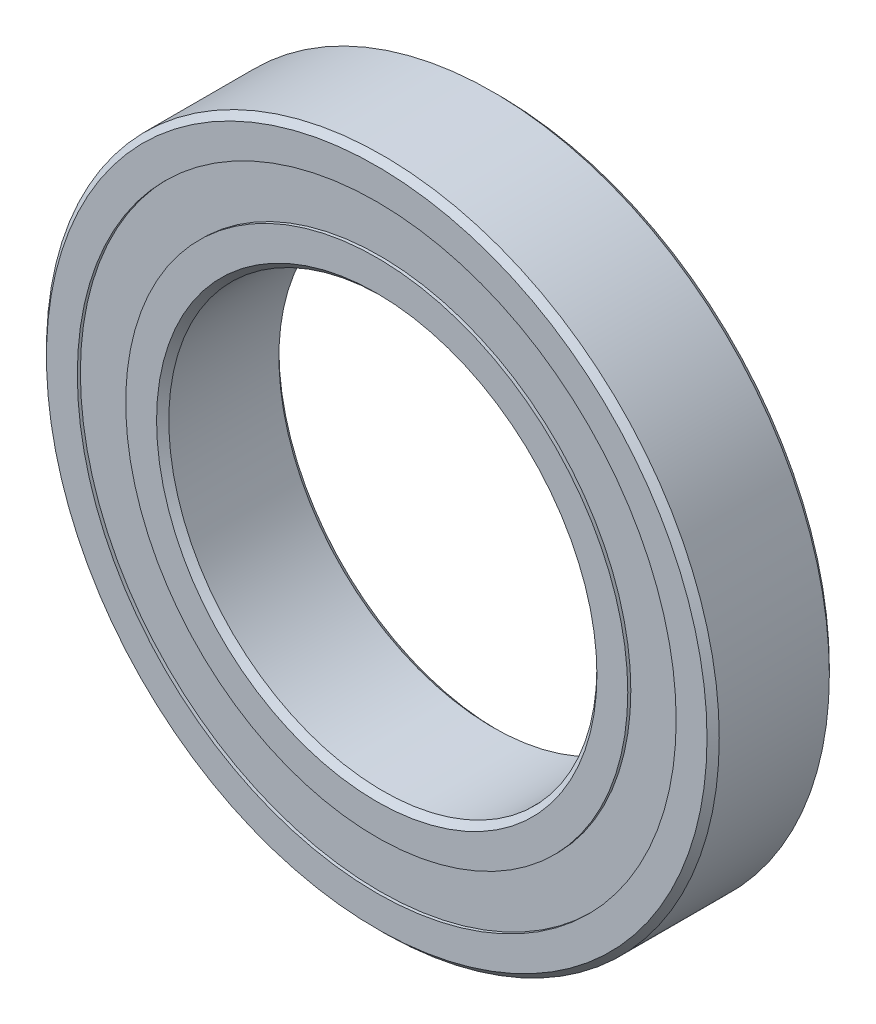
from build123d import *

# Parameters (mm, degrees)
CIRPATTERN1_COUNT = 12
SKETCH5_W         = 1.774963437
SKETCH5_H         = 3.956043956


with BuildPart() as part:
    # Sketch1 → Revolve1 (revolve)
    with BuildSketch(Plane(origin=(0, 0, 0), x_dir=(0, 0, -1), z_dir=(1, 0, 0))):
        with BuildLine():
            Line((4.5, 27.5), (-4.5, 27.5))
            Line((-4.5, 27.5), (-5, 27))
            Line((-5, 27), (-5, 24.477771978))
            Line((-5, 24.477771978), (-2.222222222, 24.477771978))
            ThreePointArc((-2.222222222, 24.477771978), (0, 25.474786563), (2.222222222, 24.477771978))
            Line((2.222222222, 24.477771978), (5, 24.477771978))
            Line((5, 24.477771978), (5, 27))
            Line((5, 27), (4.5, 27.5))
        make_face()
    revolve(axis=Axis((0, 0, 5), (0, 0, -1)))


with BuildPart() as body_2:
    # Sketch3 → Revolve3 (revolve)
    with BuildSketch(Plane(origin=(0, 0, 0), x_dir=(0, 0, -1), z_dir=(1, 0, 0))):
        with BuildLine():
            Line((-5, 20.521728022), (-2.222222222, 20.521728022))
            ThreePointArc((-2.222222222, 20.521728022), (0, 19.524713437), (2.222222222, 20.521728022))
            Line((2.222222222, 20.521728022), (5, 20.521728022))
            Line((5, 20.521728022), (5, 17.9995))
            Line((5, 17.9995), (4.5, 17.4995))
            Line((4.5, 17.4995), (-4.5, 17.4995))
            Line((-4.5, 17.4995), (-5, 17.9995))
            Line((-5, 17.9995), (-5, 20.521728022))
        make_face()
    revolve(axis=Axis((0, 0, 5), (0, 0, -1)))


with BuildPart() as body_3:
    # Sketch4 → Revolve4 (revolve)
    with BuildSketch(Plane(origin=(0, 0, 0), x_dir=(0, 0, -1), z_dir=(1, 0, 0))):
        with BuildLine():
            Line((-2.975036563, 22.49975), (2.975036563, 22.49975))
            ThreePointArc((2.975036563, 22.49975), (0, 25.474786563), (-2.975036563, 22.49975))
        make_face()
    revolve(axis=Axis((0, 22.49975, 2.975036563), (0, 0, -1)))


with BuildPart() as cirpattern1_1:
    # CirPattern1: pattern copy
    add(body_3.part.rotate(Axis((0, 0, -5), (0, 0, 1)), 1 * 360 / CIRPATTERN1_COUNT))


with BuildPart() as cirpattern1_2:
    # CirPattern1: pattern copy
    add(body_3.part.rotate(Axis((0, 0, -5), (0, 0, 1)), 2 * 360 / CIRPATTERN1_COUNT))


with BuildPart() as cirpattern1_3:
    # CirPattern1: pattern copy
    add(body_3.part.rotate(Axis((0, 0, -5), (0, 0, 1)), 3 * 360 / CIRPATTERN1_COUNT))


with BuildPart() as cirpattern1_4:
    # CirPattern1: pattern copy
    add(body_3.part.rotate(Axis((0, 0, -5), (0, 0, 1)), 4 * 360 / CIRPATTERN1_COUNT))


with BuildPart() as cirpattern1_5:
    # CirPattern1: pattern copy
    add(body_3.part.rotate(Axis((0, 0, -5), (0, 0, 1)), 5 * 360 / CIRPATTERN1_COUNT))


with BuildPart() as cirpattern1_6:
    # CirPattern1: pattern copy
    add(body_3.part.rotate(Axis((0, 0, -5), (0, 0, 1)), 6 * 360 / CIRPATTERN1_COUNT))


with BuildPart() as cirpattern1_7:
    # CirPattern1: pattern copy
    add(body_3.part.rotate(Axis((0, 0, -5), (0, 0, 1)), 7 * 360 / CIRPATTERN1_COUNT))


with BuildPart() as cirpattern1_8:
    # CirPattern1: pattern copy
    add(body_3.part.rotate(Axis((0, 0, -5), (0, 0, 1)), 8 * 360 / CIRPATTERN1_COUNT))


with BuildPart() as cirpattern1_9:
    # CirPattern1: pattern copy
    add(body_3.part.rotate(Axis((0, 0, -5), (0, 0, 1)), 9 * 360 / CIRPATTERN1_COUNT))


with BuildPart() as cirpattern1_10:
    # CirPattern1: pattern copy
    add(body_3.part.rotate(Axis((0, 0, -5), (0, 0, 1)), 10 * 360 / CIRPATTERN1_COUNT))


with BuildPart() as cirpattern1_11:
    # CirPattern1: pattern copy
    add(body_3.part.rotate(Axis((0, 0, -5), (0, 0, 1)), 11 * 360 / CIRPATTERN1_COUNT))


with BuildPart() as body_15:
    # Sketch5 → Revolve5 (revolve)
    with BuildSketch(Plane(origin=(0, 0, 0), x_dir=(0, 0, -1), z_dir=(1, 0, 0))):
        with Locations((-3.862518281, 22.49975)):
            Rectangle(SKETCH5_W, SKETCH5_H)
        with Locations((3.862518281, 22.49975)):
            Rectangle(SKETCH5_W, SKETCH5_H)
    revolve(axis=Axis((0, 0, 5), (0, 0, -1)))


solid = Compound([part.part, body_2.part, body_3.part, cirpattern1_1.part, cirpattern1_2.part, cirpattern1_3.part, cirpattern1_4.part, cirpattern1_5.part, cirpattern1_6.part, cirpattern1_7.part, cirpattern1_8.part, cirpattern1_9.part, cirpattern1_10.part, cirpattern1_11.part, body_15.part])
